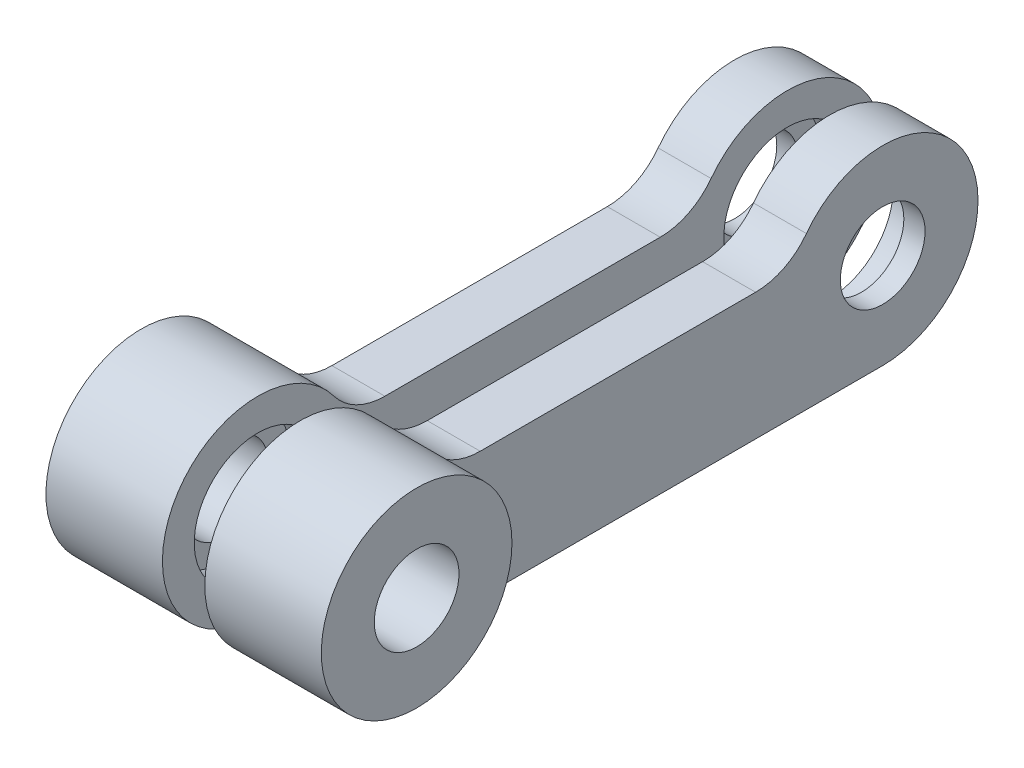
from build123d import *

# Parameters (mm, degrees)
SKETCH_1_R               = 4.5
SKETCH_1_W               = 25
SKETCH_1_H               = 6
EXTRUDE_1_DEPTH          = 2.5
EXTRUDE_START            = -3
SKETCH_1_5_R             = 4.5
EXTRUDE_3_DEPTH          = 3
CUT_EXTRUDE_2_DEPTH      = 31.253099015
CUT_EXTRUDE_2_DEPTH_BACK = 31.253099015
SKETCH_1_4_R             = 2
FILLET_1_R               = 3
SKETCH_2_R               = 3
CUT_EXTRUDE_3_DEPTH      = 1.5


with BuildPart() as part:
    # 草图1 → 凸台-拉伸1 (new body)
    with BuildSketch(Plane(origin=(0, 0, 0), x_dir=(0, 0, -1), z_dir=(1, 0, 0))):
        with Locations((0, -1.5)):
            Circle(SKETCH_1_R)
        with Locations((25, -1.5)):
            Circle(SKETCH_1_R)
        with Locations((12.5, -3)):
            Rectangle(SKETCH_1_W, SKETCH_1_H)
    extrude(amount=EXTRUDE_1_DEPTH)

    # 草图1<5> → 凸台-拉伸3 (add)
    with BuildSketch(Plane(origin=(0, 0, 0), x_dir=(0, 0, -1), z_dir=(1, 0, 0)).offset(EXTRUDE_START)):
        with Locations((0, -1.5)):
            Circle(SKETCH_1_5_R)
    extrude(amount=EXTRUDE_3_DEPTH)

    # 草图1<4> → 切除-拉伸2 (cut, two sides: drawn at the far end of the back side and taken through both)
    with BuildSketch(Plane(origin=(0, 0, 0), x_dir=(0, 0, -1), z_dir=(1, 0, 0)).offset(-CUT_EXTRUDE_2_DEPTH_BACK)):
        with Locations((0, -1.5)):
            Circle(SKETCH_1_4_R)
        with Locations((25, -1.5)):
            Circle(SKETCH_1_4_R)
    extrude(amount=CUT_EXTRUDE_2_DEPTH + CUT_EXTRUDE_2_DEPTH_BACK, mode=Mode.SUBTRACT)

    # 圆角1
    fillet_1_edges = [part.edges().sort_by_distance(p)[0] for p in [
        (1.25, 0, -20.757359313),
        (1.25, 0, -4.242640687),
    ]]
    fillet(fillet_1_edges, radius=FILLET_1_R)

    # 草图2 → 切除-拉伸3 (cut)
    with BuildSketch(Plane(origin=(2.5, 0, 0), x_dir=(0, 0, -1), z_dir=(1, 0, 0))):
        with Locations((0, -1.5)):
            Circle(SKETCH_2_R)
        with Locations((25, -1.5)):
            Circle(SKETCH_2_R)
    extrude(amount=-CUT_EXTRUDE_3_DEPTH, mode=Mode.SUBTRACT)


with BuildPart() as body_2:
    # 镜向2: mirrored copy
    add(part.part.mirror(Plane(origin=(3.5, 0, 0), x_dir=(0, 0, 1), z_dir=(1, 0, 0))))


solid = Compound([part.part, body_2.part])
